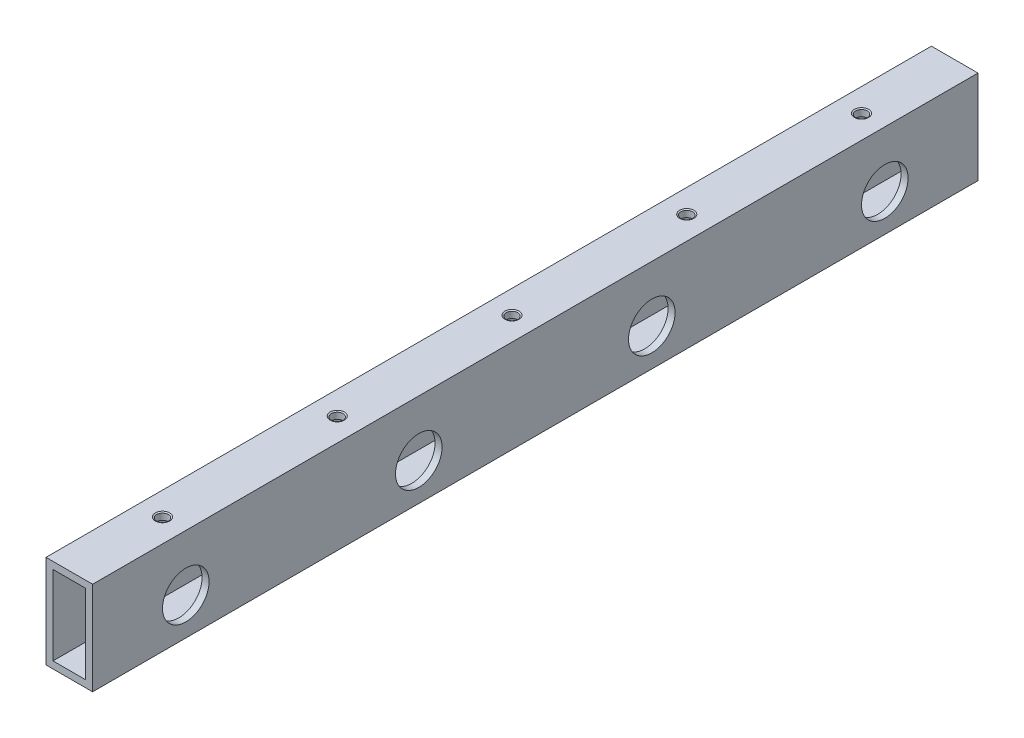
from build123d import *

# Parameters (mm, degrees)
SKETCH_1_W                  = 10
SKETCH_1_H                  = 20
SKETCH_1_W_2                = 7
SKETCH_1_H_2                = 17
EXTRUDE_1_DEPTH             = 190
HOLE_WIZARD_M31_D           = 2.5
HOLE_WIZARD_M31_DEPTH       = 8.5
HOLE_WIZARD_M31_CSINK_D     = 3.05
HOLE_WIZARD_M31_CSINK_ANGLE = 120
HOLE_WIZARD_M31_TIP         = 0.751075774
HOLE_WIZARD_2_D             = 10
HOLE_WIZARD_2_DEPTH         = 3


with BuildPart() as part:
    # Эскиз1 → Вытянуть-Тонкостенный1 (new body)
    with BuildSketch(Plane.XY):
        with Locations((5, 10)):
            Rectangle(SKETCH_1_W, SKETCH_1_H)
        with Locations((5, 10)):
            Rectangle(SKETCH_1_W_2, SKETCH_1_H_2, mode=Mode.SUBTRACT)
    extrude(amount=EXTRUDE_1_DEPTH)

    # Отверстие обработанное метчиком M31
    with Locations(Plane(origin=(0, 20, 0), x_dir=(-1, 0, 0), z_dir=(0, 1, 0))):
        with Locations((-5, 20), (-5, 57.5), (-5, 95), (-5, 132.5), (-5, 170)):
            CounterSinkHole(HOLE_WIZARD_M31_D / 2, HOLE_WIZARD_M31_CSINK_D / 2, depth=HOLE_WIZARD_M31_DEPTH, counter_sink_angle=HOLE_WIZARD_M31_CSINK_ANGLE)
            with Locations((0, 0, -(HOLE_WIZARD_M31_DEPTH + HOLE_WIZARD_M31_TIP / 2))):  # 118° drill point
                Cone(0, HOLE_WIZARD_M31_D / 2, HOLE_WIZARD_M31_TIP, mode=Mode.SUBTRACT)

    # Отверстие2
    with Locations(Plane(origin=(10, 0, 0), x_dir=(0, 0, -1), z_dir=(1, 0, 0))):
        with Locations((-170, 8), (-120, 8), (-70, 8), (-20, 8)):
            Hole(HOLE_WIZARD_2_D / 2, depth=HOLE_WIZARD_2_DEPTH)


solid = part.part
